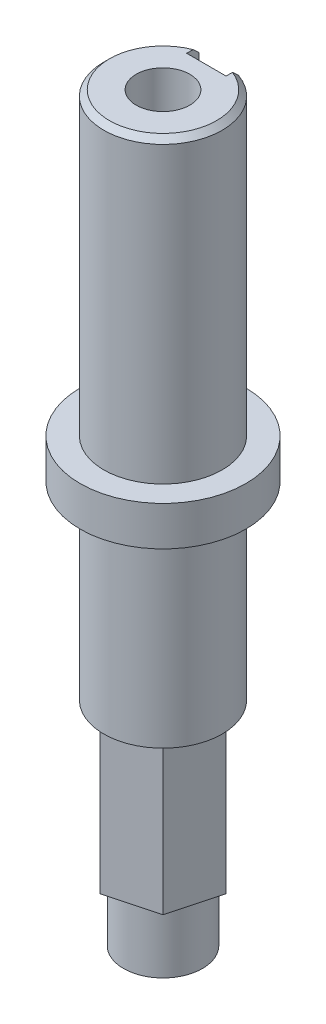
from build123d import *

# Parameters (mm, degrees)
ESBO_O2_W                                      = 5
ESBO_O2_H                                      = 6
CORTE_EXTRUS_O1_DEPTH                          = 22
CORTE_EXTRUS_O2_DEPTH                          = 2
ESBO_O5_R                                      = 12.651043405
CORTE_EXTRUS_O8_DEPTH                          = 19
BROCA_DE_ROSQUEAR_PARA_TARRAXA_DE_M5X0_8_D     = 4.2
BROCA_DE_ROSQUEAR_PARA_TARRAXA_DE_M5X0_8_DEPTH = 10
BROCA_DE_ROSQUEAR_PARA_TARRAXA_DE_M5X0_8_TIP   = 1.2618073
CHANFRO1_SIZE                                  = 0.5
ESBO_O10_W                                     = 3
ESBO_O10_H                                     = 5
BROCA_DE_ROSQUEAR_PARA_TARRAXA_DE_M81_D        = 6.8
BROCA_DE_ROSQUEAR_PARA_TARRAXA_DE_M81_DEPTH    = 20
BROCA_DE_ROSQUEAR_PARA_TARRAXA_DE_M81_TIP      = 2.042926105


with BuildPart() as part:
    # Esboço1 → Revolução1 (revolve)
    with BuildSketch(Plane.XY, mode=Mode.PRIVATE) as revolu_o1_sk:
        Polygon((6.792893219, 47), (4, 47), (0, 47), (0, 23), (0, -47), (5, -47), (5, -39), (7.5, -39), (7.5, -11), (7.5, 46.292893219), align=None)
    revolve(revolu_o1_sk.sketch.rotate(Axis((0, -47, 0), (0, -1, 0)), 90), axis=Axis((0, -47, 0), (0, -1, 0)))

    # Esboço2 → Corte-extrusão1 (cut)
    with BuildSketch(Plane(origin=(0, 47, 0), x_dir=(1, 0, 0), z_dir=(0, 1, 0))):
        with Locations((0, 8.5)):
            Rectangle(ESBO_O2_W, ESBO_O2_H)
    extrude(amount=-CORTE_EXTRUS_O1_DEPTH, mode=Mode.SUBTRACT)

    # Esboço3 → Corte-extrusão2 (cut)
    with BuildSketch(Plane(origin=(0, 25, -7.5), x_dir=(-1, 0, 0), z_dir=(0, 0, -1))):
        with BuildLine():
            Line((2.5, 0), (-2.5, 0))
            ThreePointArc((-2.5, 0), (0, -2.5), (2.5, 0))
        make_face()
    extrude(amount=-CORTE_EXTRUS_O2_DEPTH, mode=Mode.SUBTRACT)

    # Esboço5 → Corte-extrusão8 (cut)
    with BuildSketch(Plane.XZ.offset(39)):
        Circle(ESBO_O5_R)
        Polygon((-4.596194078, -4.596194078), (1.682323793, -6.278517871), (6.278517871, -1.682323793), (4.596194078, 4.596194078), (-1.682323793, 6.278517871), (-6.278517871, 1.682323793), align=None, mode=Mode.SUBTRACT)
    extrude(amount=-CORTE_EXTRUS_O8_DEPTH, mode=Mode.SUBTRACT)

    # Broca de rosquear para tarraxa de M5x0.81
    with Locations(Plane(origin=(0, -47, 0), x_dir=(-1, 0, 0), z_dir=(0, -1, 0))):
        with Locations((0, 0)):
            Hole(BROCA_DE_ROSQUEAR_PARA_TARRAXA_DE_M5X0_8_D / 2, depth=BROCA_DE_ROSQUEAR_PARA_TARRAXA_DE_M5X0_8_DEPTH)
            with Locations((0, 0, -(BROCA_DE_ROSQUEAR_PARA_TARRAXA_DE_M5X0_8_DEPTH + BROCA_DE_ROSQUEAR_PARA_TARRAXA_DE_M5X0_8_TIP / 2))):  # 118° drill point
                Cone(0, BROCA_DE_ROSQUEAR_PARA_TARRAXA_DE_M5X0_8_D / 2, BROCA_DE_ROSQUEAR_PARA_TARRAXA_DE_M5X0_8_TIP, mode=Mode.SUBTRACT)

    # Chanfro1
    chanfro1_edges = [part.edges().sort_by_distance(p)[0] for p in [
        (-2.1, -47, 0),
    ]]
    chamfer(chanfro1_edges, length=CHANFRO1_SIZE)

    # Esboço10 → Revolução2 (revolve)
    with BuildSketch(Plane(origin=(0, 0, 0), x_dir=(-0.965925826289067, 0, 0.2588190451025257), z_dir=(-0.2588190451025257, 0, -0.965925826289067)), mode=Mode.PRIVATE) as revolu_o2_sk:
        with Locations((9, 6.5)):
            Rectangle(ESBO_O10_W, ESBO_O10_H)
    revolve(revolu_o2_sk.sketch.rotate(Axis((0, -20, 0), (0, 1, 0)), 165), axis=Axis((0, -20, 0), (0, 1, 0)))

    # Broca de rosquear para tarraxa de M81
    with Locations(Plane(origin=(0, 47, 0), x_dir=(1, 0, 0), z_dir=(0, 1, 0))):
        with Locations((0, 0)):
            Hole(BROCA_DE_ROSQUEAR_PARA_TARRAXA_DE_M81_D / 2, depth=BROCA_DE_ROSQUEAR_PARA_TARRAXA_DE_M81_DEPTH)
            with Locations((0, 0, -(BROCA_DE_ROSQUEAR_PARA_TARRAXA_DE_M81_DEPTH + BROCA_DE_ROSQUEAR_PARA_TARRAXA_DE_M81_TIP / 2))):  # 118° drill point
                Cone(0, BROCA_DE_ROSQUEAR_PARA_TARRAXA_DE_M81_D / 2, BROCA_DE_ROSQUEAR_PARA_TARRAXA_DE_M81_TIP, mode=Mode.SUBTRACT)


solid = part.part
